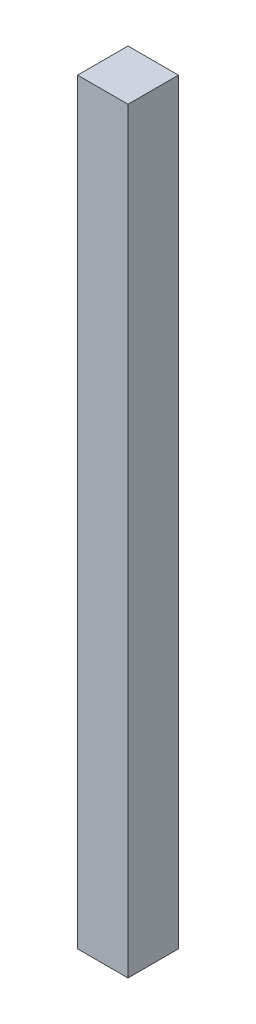
from build123d import *

# Parameters (mm, degrees)
SKETCH1_W           = 50.8
SKETCH1_H           = 50.8
BOSS_EXTRUDE1_DEPTH = 762


with BuildPart() as part:
    # Sketch1 → Boss-Extrude1 (new body)
    with BuildSketch(Plane(origin=(0, 0, 0), x_dir=(1, 0, 0), z_dir=(0, 1, 0))):
        Rectangle(SKETCH1_W, SKETCH1_H)
    extrude(amount=BOSS_EXTRUDE1_DEPTH)


solid = part.part
